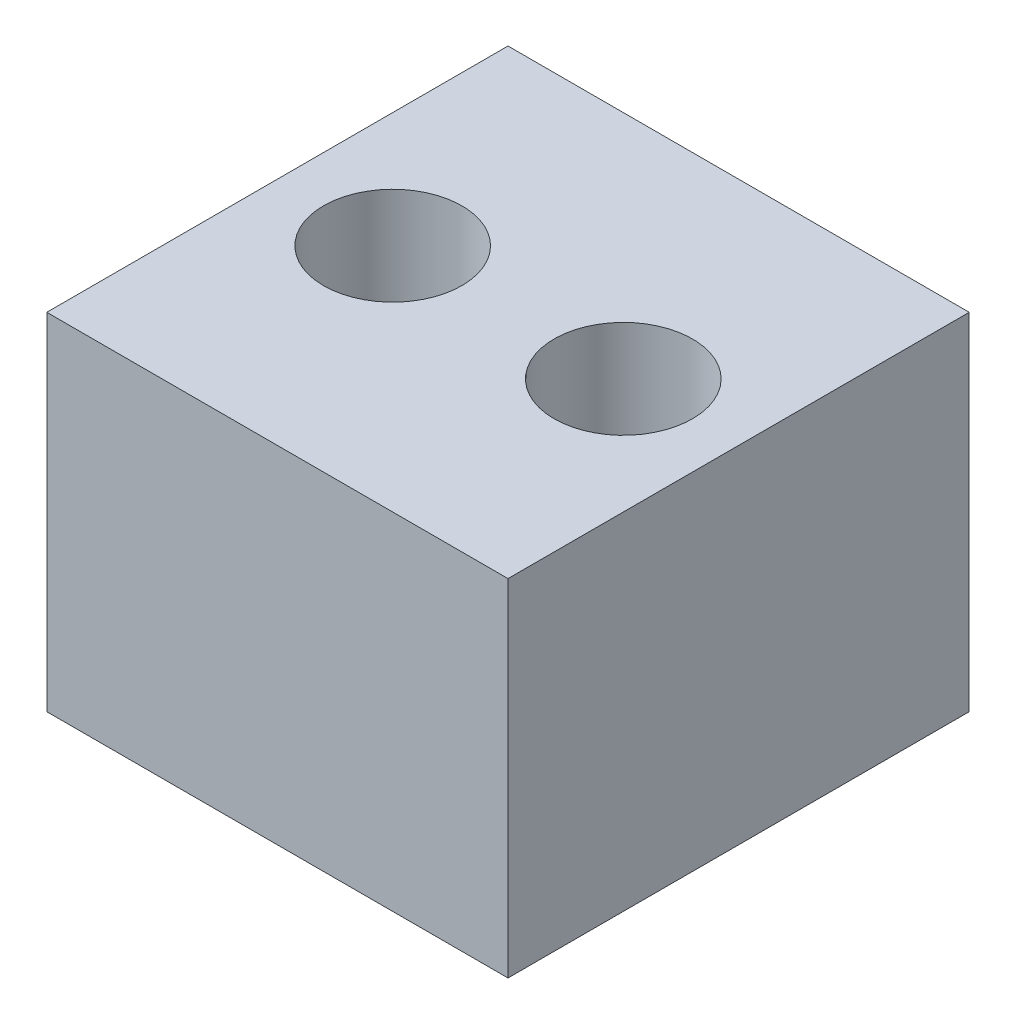
from build123d import *

# Parameters (mm, degrees)
SKETCH1_W           = 20
SKETCH1_H           = 20
BOSS_EXTRUDE1_DEPTH = 15
SKETCH2_R           = 3
CUT_EXTRUDE1_DEPTH  = 5


with BuildPart() as part:
    # Sketch1 → Boss-Extrude1 (new body)
    with BuildSketch(Plane(origin=(0, 0, 0), x_dir=(1, 0, 0), z_dir=(0, 1, 0))):
        Rectangle(SKETCH1_W, SKETCH1_H)
    extrude(amount=BOSS_EXTRUDE1_DEPTH)

    # Sketch2 → Cut-Extrude1 (cut)
    with BuildSketch(Plane(origin=(0, 15, 0), x_dir=(1, 0, 0), z_dir=(0, 1, 0))):
        with Locations(Location((5, 0, 0), (0, 0, 270))):
            Circle(SKETCH2_R)
        with Locations(Location((-5, 0, 0), (0, 0, 270))):
            Circle(SKETCH2_R)
    extrude(amount=-CUT_EXTRUDE1_DEPTH, mode=Mode.SUBTRACT)


solid = part.part
